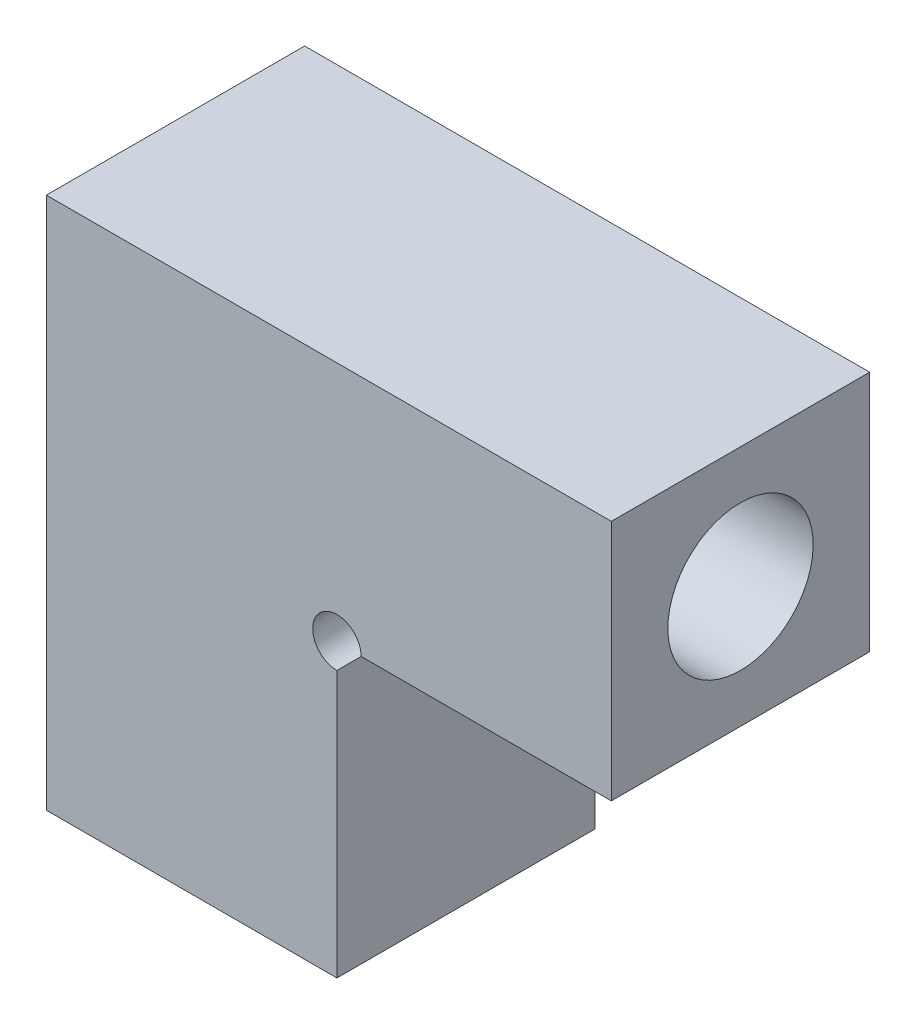
from build123d import *

# Parameters (mm, degrees)
RESSALTO_EXTRUS_O1_DEPTH = 16
ESBO_O5_R                = 4.5
CORTE_EXTRUS_O1_DEPTH    = 51.695167423


with BuildPart() as part:
    # Esboço2 → Ressalto-extrusão1 (new body)
    with BuildSketch(Plane.XY):
        with BuildLine():
            Line((0, 33), (0, 0))
            Line((0, 0), (18, 0))
            Line((18, 0), (18, 16.5))
            ThreePointArc((18, 16.5), (16.939339828, 19.060660172), (19.5, 18))
            Line((19.5, 18), (35, 18))
            Line((35, 18), (35, 33))
            Line((35, 33), (0, 33))
        make_face()
    extrude(amount=RESSALTO_EXTRUS_O1_DEPTH)

    # Esboço5 → Corte-extrusão1 (cut, through all)
    with BuildSketch(Plane(origin=(35, 0, 0), x_dir=(0, 0, -1), z_dir=(1, 0, 0))):
        with Locations(Location((-8, 25.5, 0), (0, 0, 90))):
            Circle(ESBO_O5_R)
    extrude(amount=-CORTE_EXTRUS_O1_DEPTH, mode=Mode.SUBTRACT)


solid = part.part
